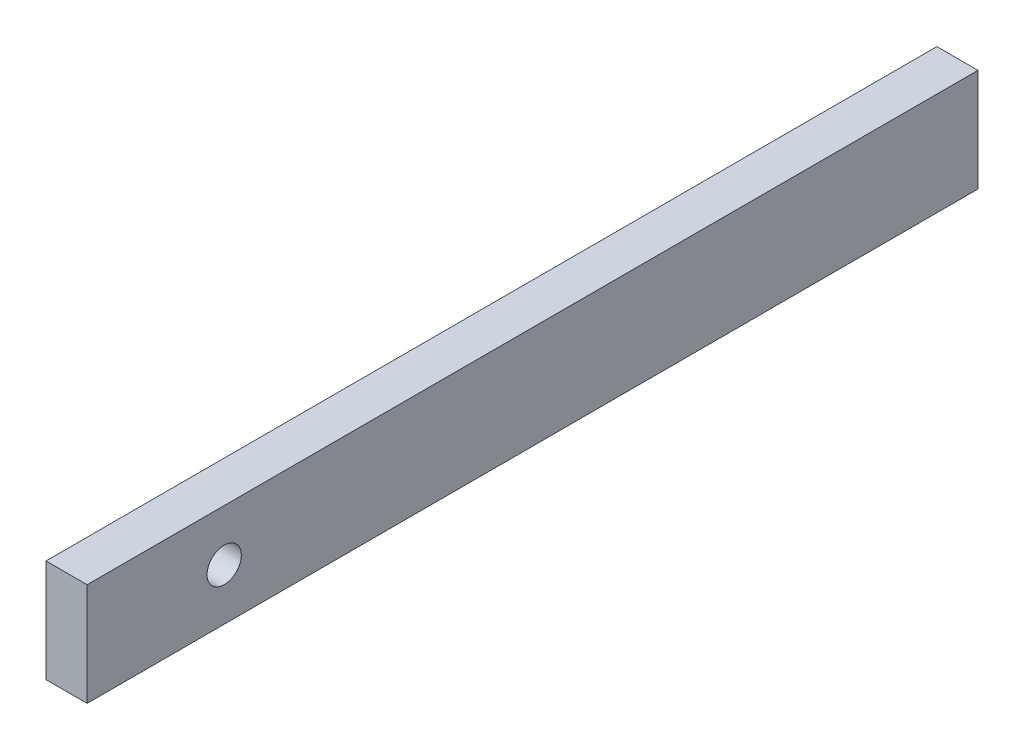
from build123d import *

# Parameters (mm, degrees)
ESQUISSE1_W             = 6
ESQUISSE1_H             = 15
BOSS_EXTRU_1_DEPTH      = 170
ESQUISSE2_R             = 2.5
ENL_V_MAT_EXTRU_1_DEPTH = 10
SKETCH1_W               = 6
SKETCH1_H               = 15
CUT_EXTRUDE1_DEPTH      = 40


with BuildPart() as part:
    # Esquisse1 → Boss.-Extru.1 (new body)
    with BuildSketch(Plane.XY):
        Rectangle(ESQUISSE1_W, ESQUISSE1_H)
    extrude(amount=BOSS_EXTRU_1_DEPTH)

    # Esquisse2 → Enlèv. mat.-Extru.1 (cut)
    with BuildSketch(Plane(origin=(3, 0, 0), x_dir=(0, 0, -1), z_dir=(1, 0, 0))):
        with Locations(Location((-150, 0, 0), (0, 0, 90))):
            Circle(ESQUISSE2_R)
    extrude(amount=-ENL_V_MAT_EXTRU_1_DEPTH, mode=Mode.SUBTRACT)

    # Sketch1 → Cut-Extrude1 (cut)
    with BuildSketch(Plane(origin=(0, 0, 0), x_dir=(-1, 0, 0), z_dir=(0, 0, -1))):
        Rectangle(SKETCH1_W, SKETCH1_H)
    extrude(amount=-CUT_EXTRUDE1_DEPTH, mode=Mode.SUBTRACT)


solid = part.part
